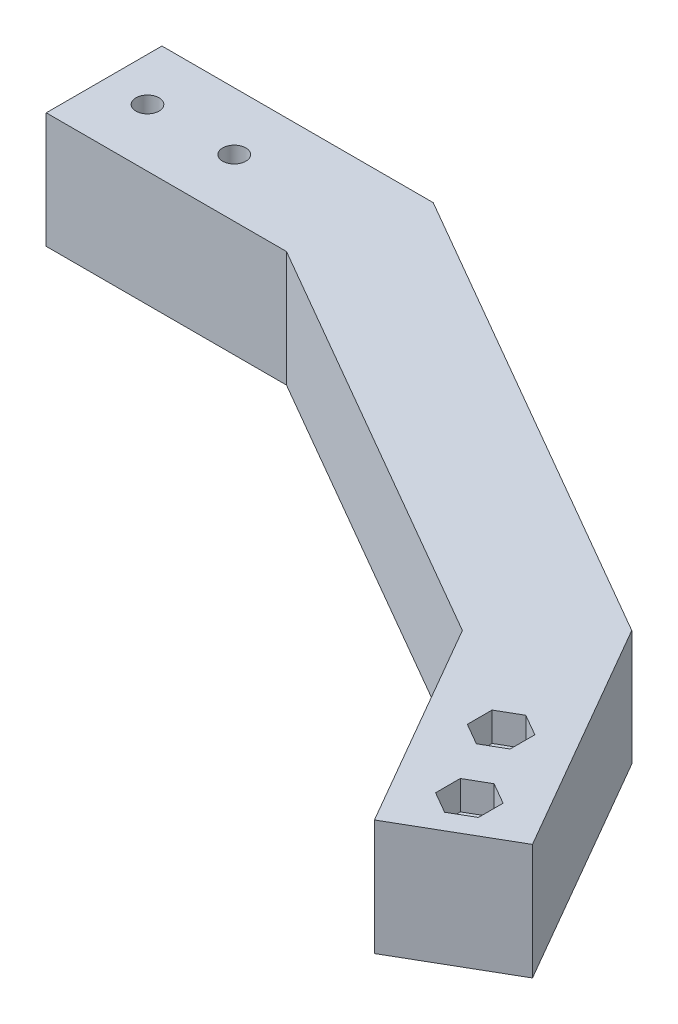
from build123d import *

# Parameters (mm, degrees)
BOSS_EXTRUDE1_DEPTH = 20
SKETCH2_R           = 2
CUT_EXTRUDE1_DEPTH  = 233.365552524
CUT_EXTRUDE2_START  = -15
SKETCH2_3_R         = 2
CUT_EXTRUDE2_DEPTH  = 5
SKETCH2_4_R         = 2
CUT_EXTRUDE3_DEPTH  = 5


with BuildPart() as part:
    # Sketch1 → Boss-Extrude1 (new body)
    with BuildSketch(Plane(origin=(0, 0, 0), x_dir=(1, 0, 0), z_dir=(0, 1, 0))):
        Polygon((0, 155), (0, 175), (46.891108675, 175), (128.108891325, 128.108891325), (151.554445662, 87.5), (134.233937587, 77.5), (113.467875173, 113.467875173), (41.532124827, 155), align=None)
    extrude(amount=BOSS_EXTRUDE1_DEPTH)

    # Sketch2 → Cut-Extrude1 (cut, through all)
    with BuildSketch(Plane(origin=(0, 20, 0), x_dir=(1, 0, 0), z_dir=(0, 1, 0))):
        with Locations(Location((7.5, 165, 0), (0, 0, 270))):
            Circle(SKETCH2_R)
        with Locations(Location((22.5, 165, 0), (0, 0, 270))):
            Circle(SKETCH2_R)
        with Locations(Location((131.644191624, 101.985571585, 0), (0, 0, 270))):
            Circle(SKETCH2_R)
        with Locations(Location((139.144191624, 88.995190528, 0), (0, 0, 90))):
            Circle(SKETCH2_R)
    extrude(amount=-CUT_EXTRUDE1_DEPTH, mode=Mode.SUBTRACT)

    # Sketch2<3> → Cut-Extrude2 (cut)
    # profile 1 of 2: a face of its own
    with BuildSketch(Plane(origin=(0, 20, 0), x_dir=(1, 0, 0), z_dir=(0, 1, 0)).offset(CUT_EXTRUDE2_START)):
        Polygon((3.8, 167.136195996), (3.8, 162.863804004), (7.5, 160.727608008), (11.2, 162.863804004), (11.2, 167.136195996), (7.5, 169.272391992), align=None)
        with Locations(Location((7.5, 165, 0), (0, 0, 270))):
            Circle(SKETCH2_3_R, mode=Mode.SUBTRACT)
    # profile 2 of 2: a face of its own
    with BuildSketch(Plane(origin=(0, 20, 0), x_dir=(1, 0, 0), z_dir=(0, 1, 0)).offset(CUT_EXTRUDE2_START)):
        Polygon((26.2, 162.863804004), (26.2, 167.136195996), (22.5, 169.272391992), (18.8, 167.136195996), (18.8, 162.863804004), (22.5, 160.727608008), align=None)
        with Locations(Location((22.5, 165, 0), (0, 0, 270))):
            Circle(SKETCH2_3_R, mode=Mode.SUBTRACT)
    extrude(amount=-CUT_EXTRUDE2_DEPTH, mode=Mode.SUBTRACT)

    # Sketch2<4> → Cut-Extrude3 (cut)
    # profile 1 of 2: a face of its own
    with BuildSketch(Plane(origin=(0, 20, 0), x_dir=(1, 0, 0), z_dir=(0, 1, 0))):
        Polygon((135.344191624, 104.121767581), (135.344191624, 99.849375589), (131.644191624, 97.713179593), (127.944191624, 99.849375589), (127.944191624, 104.121767581), (131.644191624, 106.257963577), align=None)
        with Locations(Location((131.644191624, 101.985571585, 0), (0, 0, 270))):
            Circle(SKETCH2_4_R, mode=Mode.SUBTRACT)
    # profile 2 of 2: a face of its own
    with BuildSketch(Plane(origin=(0, 20, 0), x_dir=(1, 0, 0), z_dir=(0, 1, 0))):
        Polygon((135.444191624, 86.858994532), (135.444191624, 91.131386524), (139.144191624, 93.26758252), (142.844191624, 91.131386524), (142.844191624, 86.858994532), (139.144191624, 84.722798536), align=None)
        with Locations(Location((139.144191624, 88.995190528, 0), (0, 0, 270))):
            Circle(SKETCH2_4_R, mode=Mode.SUBTRACT)
    extrude(amount=-CUT_EXTRUDE3_DEPTH, mode=Mode.SUBTRACT)


solid = part.part
